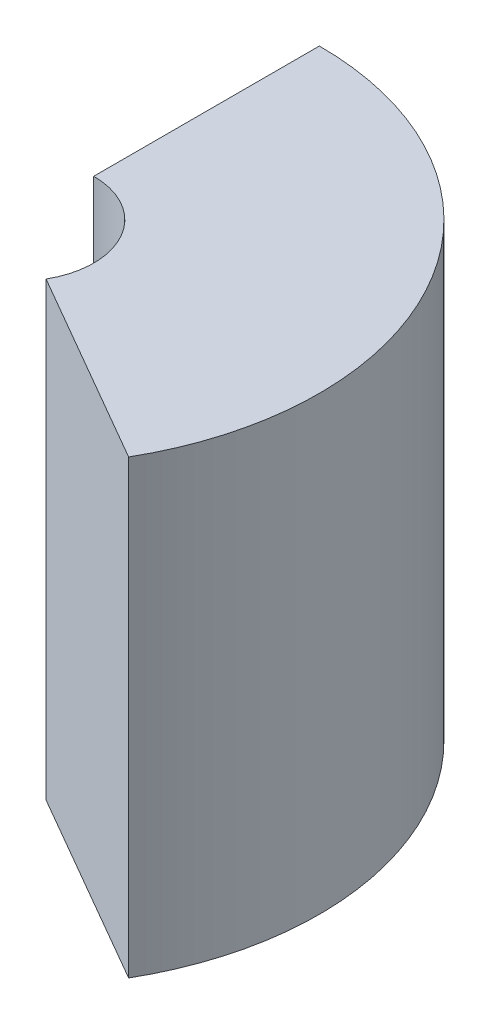
from build123d import *

# Parameters (mm, degrees)
SKETCH1_W      = 15
SKETCH1_H      = 30
REVOLVE1_ANGLE = 120


with BuildPart() as part:
    # Sketch1 → Revolve1 (revolve)
    with BuildSketch(Plane(origin=(0, 0, 0), x_dir=(0, 0, -1), z_dir=(1, 0, 0))):
        with Locations((12.5, 15)):
            Rectangle(SKETCH1_W, SKETCH1_H)
    revolve(axis=Axis((0, 0, 0), (0, -1, 0)), revolution_arc=REVOLVE1_ANGLE)


solid = part.part
